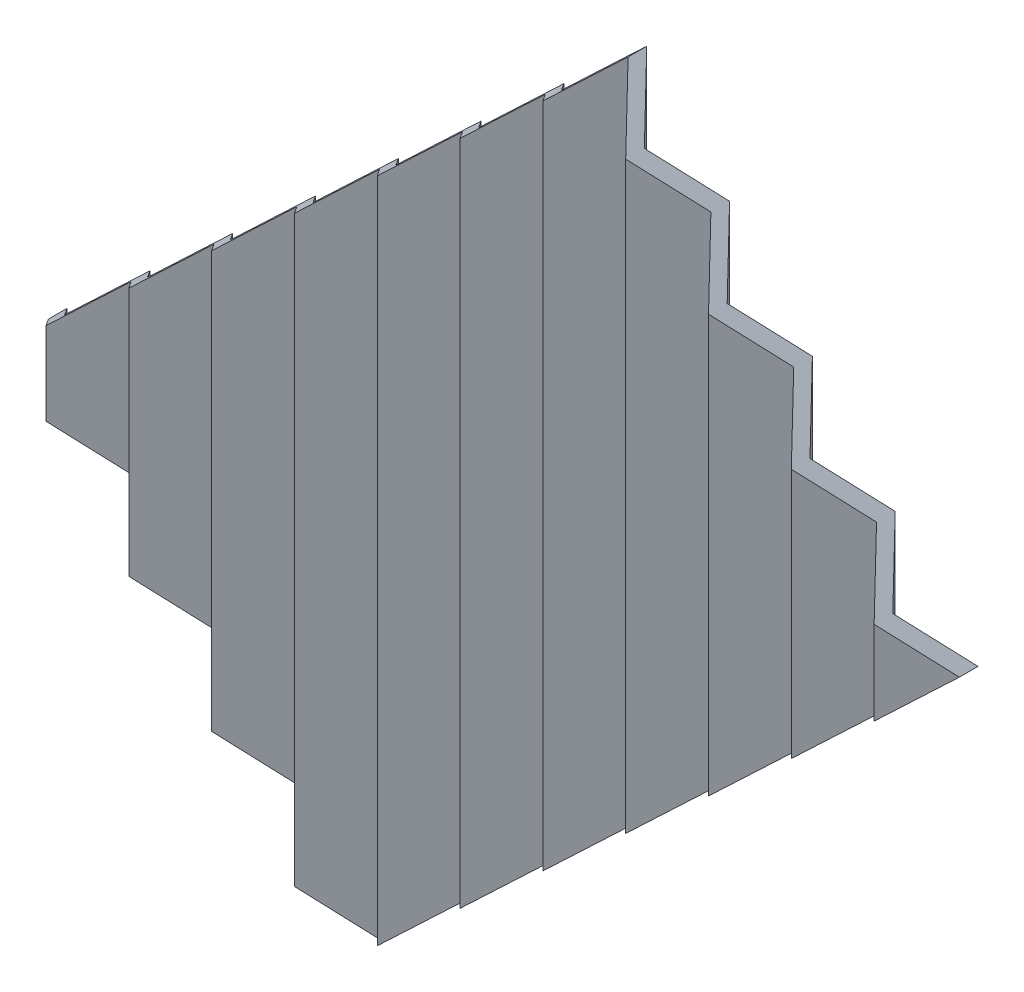
from build123d import *

# Parameters (mm, degrees)
BOSS_EXTRU_1_DEPTH         = 200
R_P_TITION_LIN_AIRE1_COUNT = 15
R_P_TITION_LIN_AIRE1_PITCH = 13.31
ESQUISSE4_OUTSIDE_W        = 258.204
ESQUISSE4_OUTSIDE_H        = 258.554
ENL_V_MAT_EXTRU_2_DEPTH    = 150


with BuildPart() as part:
    # Esquisse1 → Boss.-Extru.1 (new body)
    with BuildSketch(Plane(origin=(0, 0, 0), x_dir=(1, 0, 0), z_dir=(0, 1, 0))):
        Polygon((0, 10), (6.615825808, 3), (6.615825808, 0), (0, 7), (-6.694174192, 0), (-6.694174192, 3), align=None)
    boss_extru_1 = extrude(amount=BOSS_EXTRU_1_DEPTH)

    # Répétition linéaire1: Boss.-Extru.1 ×15
    with Locations(*[(i * R_P_TITION_LIN_AIRE1_PITCH, 0, 0) for i in range(1, R_P_TITION_LIN_AIRE1_COUNT)]):
        add(boss_extru_1)

    # Esquisse4 outside → Enlèv. mat.-Extru.2 (cut)
    with BuildSketch(Plane.XY.offset(-10)):
        with Locations((93.131, 100)):
            Rectangle(ESQUISSE4_OUTSIDE_W, ESQUISSE4_OUTSIDE_H)
        Polygon((66.55, 25.147148524), (159.72, 108.218978148), (106.48, 167.930806122), (13.31, 84.858976498), align=None, mode=Mode.SUBTRACT)
    extrude(amount=ENL_V_MAT_EXTRU_2_DEPTH, mode=Mode.SUBTRACT)


solid = part.part
